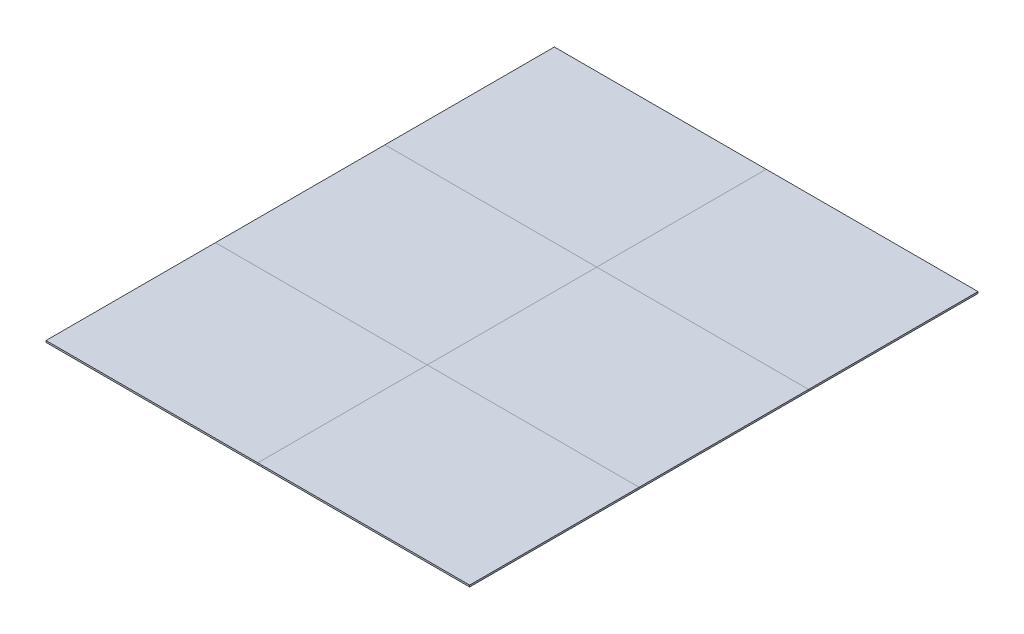
from build123d import *

# Parameters (mm, degrees)
SKETCH_1_W               = 2500
SKETCH_1_H               = 2000
EXTRUDE_1_DEPTH          = 20
PATTERN_LINEAR_2_COUNT   = 3
PATTERN_LINEAR_2_PITCH   = 2000
PATTERN_LINEAR_2_2_COUNT = 2
PATTERN_LINEAR_2_2_PITCH = 2500


with BuildPart() as part:
    # 草图1 → 凸台-拉伸1 (new body)
    with BuildSketch(Plane(origin=(0, 0, 0), x_dir=(1, 0, 0), z_dir=(0, 1, 0))):
        with Locations((1250, 1000)):
            Rectangle(SKETCH_1_W, SKETCH_1_H)
    extrude(amount=-EXTRUDE_1_DEPTH)


with BuildPart() as pattern_linear_2_1:
    # 阵列(线性)2: pattern copy
    add(part.part.moved(Location(Vector(0, 0, -1) * (1 * PATTERN_LINEAR_2_PITCH))))


with BuildPart() as pattern_linear_2_2:
    # 阵列(线性)2: pattern copy
    add(part.part.moved(Location(Vector(0, 0, -1) * (2 * PATTERN_LINEAR_2_PITCH))))


with BuildPart() as pattern_linear_2_2_1:
    # Pattern Linear 2 2: pattern copy
    add(part.part.moved(Location(Vector(1, 0, 0) * (1 * PATTERN_LINEAR_2_2_PITCH))))


with BuildPart() as pattern_linear_2_2_2:
    # Pattern Linear 2 2: pattern copy
    add(pattern_linear_2_1.part.moved(Location(Vector(1, 0, 0) * (1 * PATTERN_LINEAR_2_2_PITCH))))


with BuildPart() as pattern_linear_2_2_3:
    # Pattern Linear 2 2: pattern copy
    add(pattern_linear_2_2.part.moved(Location(Vector(1, 0, 0) * (1 * PATTERN_LINEAR_2_2_PITCH))))


solid = Compound([part.part, pattern_linear_2_1.part, pattern_linear_2_2.part, pattern_linear_2_2_1.part, pattern_linear_2_2_2.part, pattern_linear_2_2_3.part])
